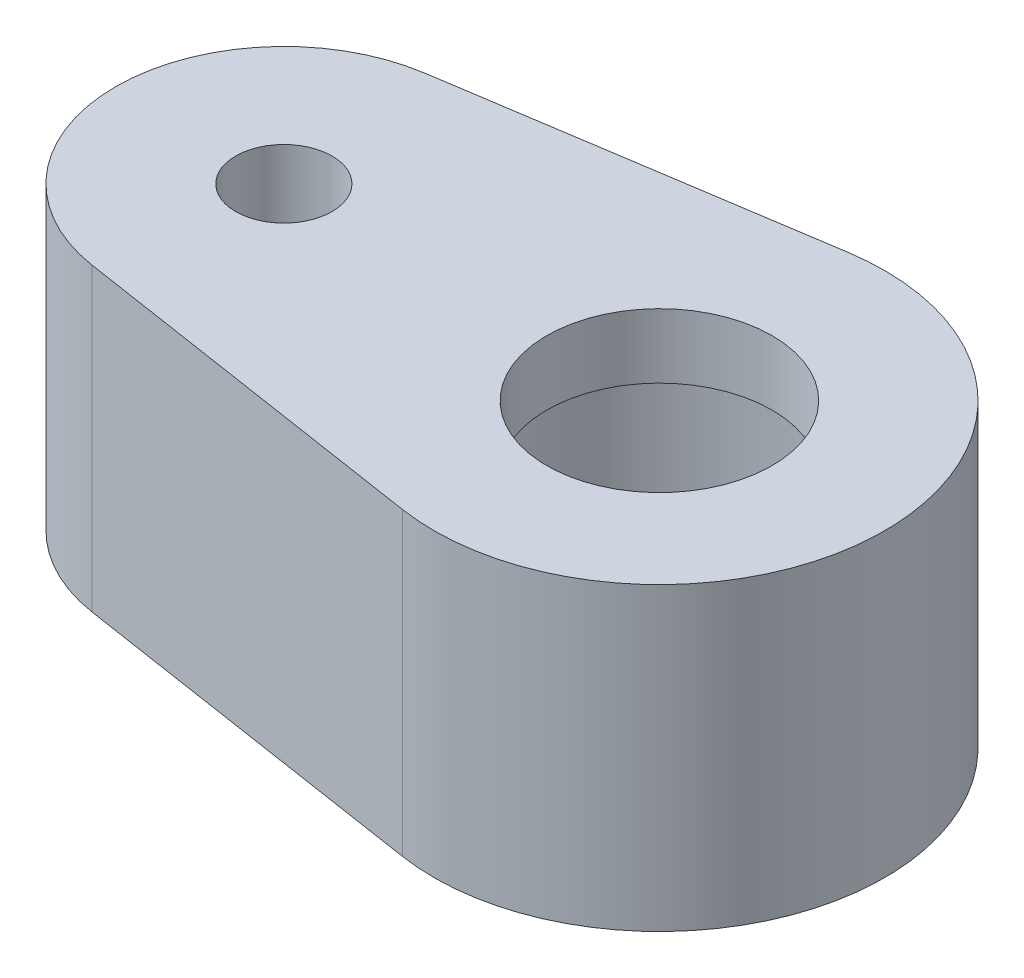
from build123d import *

# Parameters (mm, degrees)
BOSS_EXTRUDE1_DEPTH      = 1
BOSS_EXTRUDE1_DEPTH_BACK = 1
CUT_EXTRUDE1_REACH       = 6.399
SKETCH5_R                = 0.3207


with BuildPart() as part:
    # Sketch1 → Boss-Extrude1 (new, two sides: drawn at the far end of the back side and taken through both)
    with BuildSketch(Plane(origin=(0, 0, 0), x_dir=(1, 0, 0), z_dir=(0, 1, 0)).offset(-BOSS_EXTRUDE1_DEPTH_BACK)):
        with BuildLine():
            Line((-2.67024, 1.106986153), (-0.228, 1.48257074))
            ThreePointArc((-0.228, 1.48257074), (1.5, 0), (-0.228, -1.48257074))
            Line((-0.228, -1.48257074), (-2.67024, -1.106986153))
            ThreePointArc((-2.67024, -1.106986153), (-3.62, 0), (-2.67024, 1.106986153))
        make_face()
    extrude(amount=BOSS_EXTRUDE1_DEPTH + BOSS_EXTRUDE1_DEPTH_BACK)

    # Sketch4 → Cut-Revolve1 (revolve, cut)
    with BuildSketch(Plane.XY):
        Polygon((1.145, 0), (1.145, 0.465), (0.75, 0.570839931), (0.75, 1), (0, 1), (0, -1), (0.75, -1), (0.75, -0.570839931), (1.145, -0.465), align=None)
    revolve(axis=Axis((0, -1, 0), (0, 1, 0)), mode=Mode.SUBTRACT)

    # Sketch5 → Cut-Extrude1 (cut, up to next)
    with BuildSketch(Plane(origin=(0, 1, 0), x_dir=(1, 0, 0), z_dir=(0, 1, 0)), mode=Mode.PRIVATE) as cut_extrude1_sk1:
        with Locations((-2.5, 0)):
            Circle(SKETCH5_R)
    cut_extrude1_tool1 = extrude(cut_extrude1_sk1.sketch, amount=-CUT_EXTRUDE1_REACH, mode=Mode.PRIVATE) & part.part
    add(cut_extrude1_tool1.solids().sort_by_distance((-2.5, 1, 0))[0], mode=Mode.SUBTRACT)


solid = part.part
